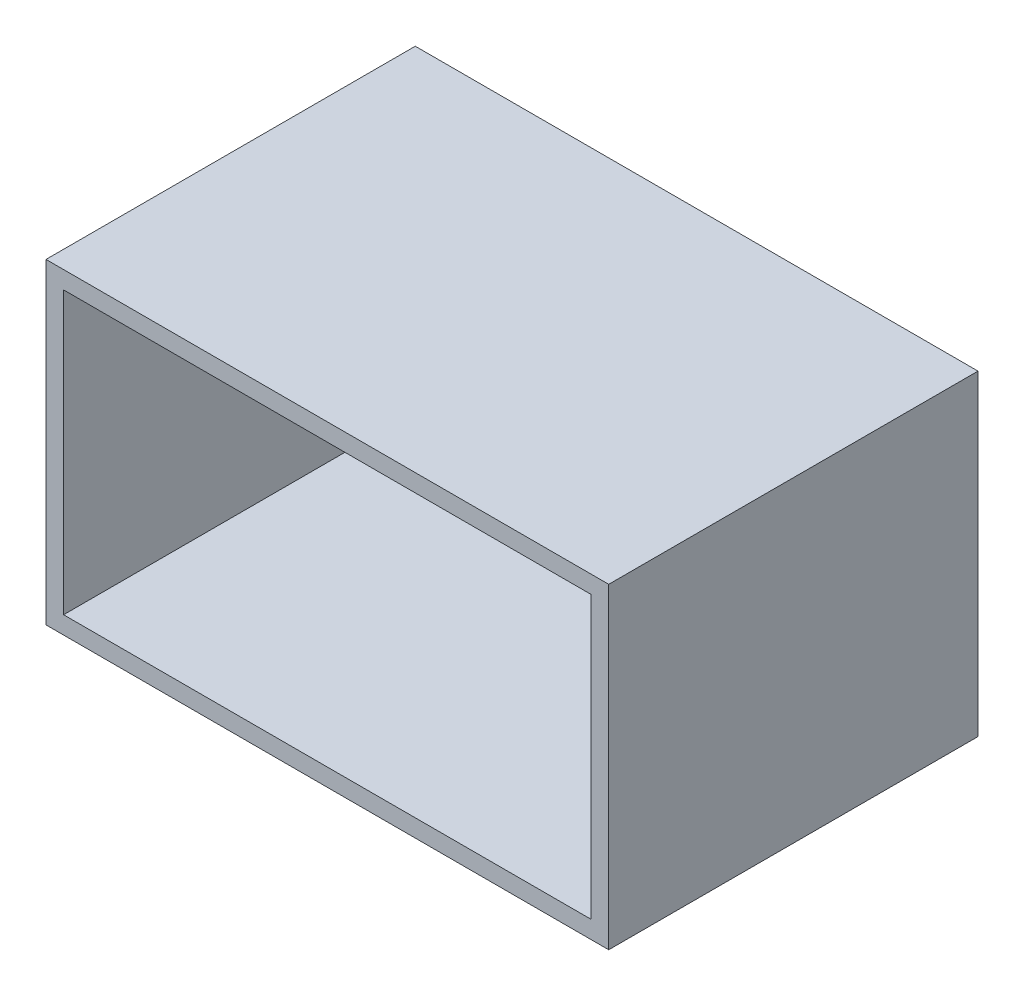
from build123d import *

# Parameters (mm, degrees)
SKETCH_1_W          = 160
SKETCH_1_H          = 90
EXTRUDE_1_DEPTH     = 105
SKETCH_2_W          = 150
SKETCH_2_H          = 80
CUT_EXTRUDE_1_DEPTH = 100


with BuildPart() as part:
    # 草圖1 → 填料-伸長1 (new body)
    with BuildSketch(Plane.XY):
        Rectangle(SKETCH_1_W, SKETCH_1_H)
    extrude(amount=EXTRUDE_1_DEPTH)

    # 草圖2 → 除料-伸長1 (cut)
    with BuildSketch(Plane.XY.offset(105)):
        Rectangle(SKETCH_2_W, SKETCH_2_H)
    extrude(amount=-CUT_EXTRUDE_1_DEPTH, mode=Mode.SUBTRACT)


solid = part.part
